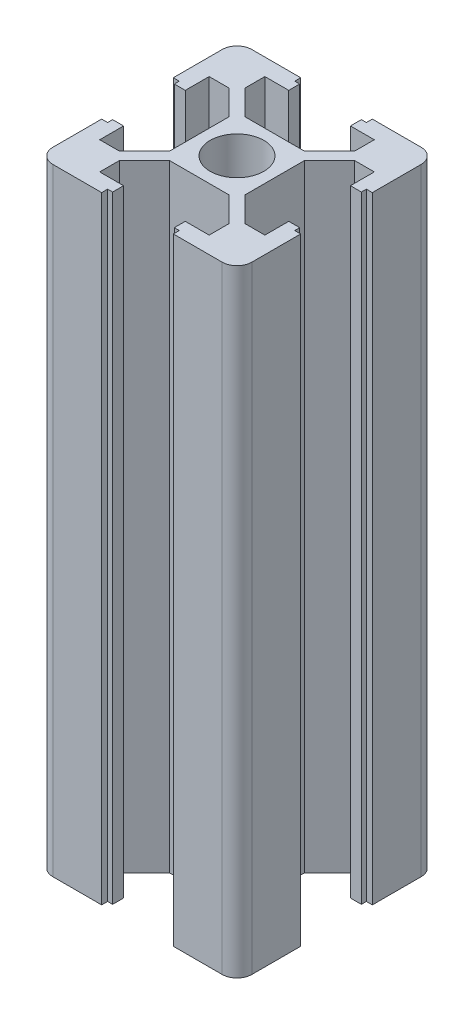
from build123d import *

# Parameters (mm, degrees)
SKETCH_1_W               = 20
SKETCH_1_H               = 20
EXTRUDE_1_DEPTH          = 31
SKETCH_4_R               = 2.7
CUT_EXTRUDE_3_DEPTH      = 9999
SKETCH_2_W               = 7.2
SKETCH_2_H               = 1.2
SKETCH_2_W_2             = 6.2
SKETCH_2_H_2             = 3.4
CUT_EXTRUDE_1_DEPTH      = 9999
CUT_EXTRUDE_2_DEPTH      = 9999
PATTERN_CIRCULAR_5_COUNT = 4
FILLET_1_R               = 1.5


with BuildPart() as part:
    # 草图1 → 凸台-拉伸1 (new, symmetric)
    with BuildSketch(Plane(origin=(0, 0, 0), x_dir=(1, 0, 0), z_dir=(0, 1, 0))):
        Rectangle(SKETCH_1_W, SKETCH_1_H)
    extrude(amount=EXTRUDE_1_DEPTH, both=True)

    # 草图4 → 切除-拉伸3 (cut)
    with BuildSketch(Plane(origin=(0, 31, 0), x_dir=(1, 0, 0), z_dir=(0, 1, 0))):
        with Locations(Location((0, 0, 0), (0, 0, 270))):
            Circle(SKETCH_4_R)
    extrude(amount=-CUT_EXTRUDE_3_DEPTH, mode=Mode.SUBTRACT)

    # 草图2 → 切除-拉伸1 (cut)
    with BuildSketch(Plane(origin=(0, 31, 0), x_dir=(1, 0, 0), z_dir=(0, 1, 0))):
        with Locations((0, 10)):
            Rectangle(SKETCH_2_W, SKETCH_2_H)
        with Locations((0, 10)):
            Rectangle(SKETCH_2_W_2, SKETCH_2_H_2)
    cut_extrude_1 = extrude(amount=-CUT_EXTRUDE_1_DEPTH, mode=Mode.SUBTRACT)

    # 草图3 → 切除-拉伸2 (cut)
    with BuildSketch(Plane(origin=(0, 31, 0), x_dir=(1, 0, 0), z_dir=(0, 1, 0))):
        Polygon((5.5, 8.3), (-5.5, 8.3), (-5.5, 6.3), (-3, 3.8), (3, 3.8), (5.5, 6.3), align=None)
    cut_extrude_2 = extrude(amount=-CUT_EXTRUDE_2_DEPTH, mode=Mode.SUBTRACT)

    # 阵列(圆周)5: 切除-拉伸1, 切除-拉伸2 ×4 about axis
    pattern_circular_5_axis = Axis((0, 0, 0), (0, 1, 0))
    add([cut_extrude_1.rotate(pattern_circular_5_axis, i * 360 / PATTERN_CIRCULAR_5_COUNT) for i in range(1, PATTERN_CIRCULAR_5_COUNT)], mode=Mode.SUBTRACT)
    add([cut_extrude_2.rotate(pattern_circular_5_axis, i * 360 / PATTERN_CIRCULAR_5_COUNT) for i in range(1, PATTERN_CIRCULAR_5_COUNT)], mode=Mode.SUBTRACT)

    # 圆角1
    fillet_1_edges = [part.edges().sort_by_distance(p)[0] for p in [
        (10, 0, 10),
        (-10, 0, 10),
        (-10, 0, -10),
        (10, 0, -10),
    ]]
    fillet(fillet_1_edges, radius=FILLET_1_R)


solid = part.part
